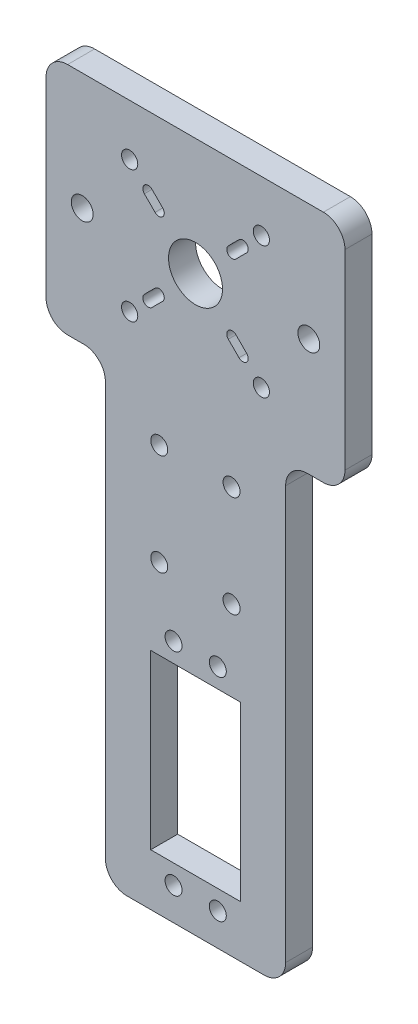
from build123d import *

# Parameters (mm, degrees)
SKETCH1_R           = 2
SKETCH1_R_2         = 6.35
SKETCH1_R_3         = 1.905
SKETCH1_R_4         = 2.575
SKETCH1_W           = 21.082
SKETCH1_H           = 40.64
BOSS_EXTRUDE1_DEPTH = 3.175


with BuildPart() as part:
    # Sketch1 → Boss-Extrude1 (new, symmetric)
    with BuildSketch(Plane.XY):
        with BuildLine():
            Line((-16.129, -83.74), (16.129, -83.74))
            ThreePointArc((16.129, -83.74), (19.721102448, -82.252102448), (21.209, -78.66))
            Line((21.209, -78.66), (21.209, 18.542))
            ThreePointArc((21.209, 18.542), (22.696897552, 22.134102448), (26.289, 23.622))
            Line((26.289, 23.622), (30.099, 23.622))
            ThreePointArc((30.099, 23.622), (33.691102448, 25.109897552), (35.179, 28.702))
            Line((35.179, 28.702), (35.179, 73.66))
            ThreePointArc((35.179, 73.66), (33.691102448, 77.252102448), (30.099, 78.74))
            Line((30.099, 78.74), (-30.099, 78.74))
            ThreePointArc((-30.099, 78.74), (-33.691102448, 77.252102448), (-35.179, 73.66))
            Line((-35.179, 73.66), (-35.179, 28.702))
            ThreePointArc((-35.179, 28.702), (-33.691102448, 25.109897552), (-30.099, 23.622))
            Line((-30.099, 23.622), (-26.289, 23.622))
            ThreePointArc((-26.289, 23.622), (-22.696897552, 22.134102448), (-21.209, 18.542))
            Line((-21.209, 18.542), (-21.209, -78.66))
            ThreePointArc((-21.209, -78.66), (-19.721102448, -82.252102448), (-16.129, -83.74))
        make_face()
        with Locations((8.4836, 11.938)):
            Circle(SKETCH1_R, mode=Mode.SUBTRACT)
        with Locations((-8.5344, 11.938)):
            Circle(SKETCH1_R, mode=Mode.SUBTRACT)
        with Locations((-8.5344, -11.938)):
            Circle(SKETCH1_R, mode=Mode.SUBTRACT)
        with Locations((8.4836, -11.938)):
            Circle(SKETCH1_R, mode=Mode.SUBTRACT)
        with Locations((0, 51.181)):
            Circle(SKETCH1_R_2, mode=Mode.SUBTRACT)
        with Locations((15.494, 66.675)):
            Circle(SKETCH1_R_3, mode=Mode.SUBTRACT)
        with Locations((-15.494, 66.675)):
            Circle(SKETCH1_R_3, mode=Mode.SUBTRACT)
        with Locations((-15.494, 35.687)):
            Circle(SKETCH1_R_3, mode=Mode.SUBTRACT)
        with Locations((15.494, 35.687)):
            Circle(SKETCH1_R_3, mode=Mode.SUBTRACT)
        with Locations((-5.1689, -26.32)):
            Circle(SKETCH1_R, mode=Mode.SUBTRACT)
        with Locations((5.2451, -26.32)):
            Circle(SKETCH1_R, mode=Mode.SUBTRACT)
        with Locations((5.2451, -76.104)):
            Circle(SKETCH1_R, mode=Mode.SUBTRACT)
        with Locations((-5.1689, -76.104)):
            Circle(SKETCH1_R, mode=Mode.SUBTRACT)
        with Locations((-26.67, 51.181)):
            Circle(SKETCH1_R_4, mode=Mode.SUBTRACT)
        with Locations(Location((26.67, 51.181, 0), (0, 0, 180))):
            Circle(SKETCH1_R_4, mode=Mode.SUBTRACT)
        with BuildLine():
            Line((7.723020264, 60.700071488), (10.237491978, 63.214543202))
            ThreePointArc((10.237491978, 63.214543202), (12.033543202, 63.214543202), (12.033543202, 61.418491978))
            Line((12.033543202, 61.418491978), (9.519071488, 58.904020264))
            ThreePointArc((9.519071488, 58.904020264), (7.723020264, 58.904020264), (7.723020264, 60.700071488))
        make_face(mode=Mode.SUBTRACT)
        with BuildLine():
            Line((-9.519071488, 58.904020264), (-12.033543202, 61.418491978))
            ThreePointArc((-12.033543202, 61.418491978), (-12.033543202, 63.214543202), (-10.237491978, 63.214543202))
            Line((-10.237491978, 63.214543202), (-7.723020264, 60.700071488))
            ThreePointArc((-7.723020264, 60.700071488), (-7.723020264, 58.904020264), (-9.519071488, 58.904020264))
        make_face(mode=Mode.SUBTRACT)
        with Locations((0, -51.212)):
            Rectangle(SKETCH1_W, SKETCH1_H, mode=Mode.SUBTRACT)
        with BuildLine():
            Line((-7.723020264, 41.661928512), (-10.237491978, 39.147456798))
            ThreePointArc((-10.237491978, 39.147456798), (-12.033543202, 39.147456798), (-12.033543202, 40.943508022))
            Line((-12.033543202, 40.943508022), (-9.519071488, 43.457979736))
            ThreePointArc((-9.519071488, 43.457979736), (-7.723020264, 43.457979736), (-7.723020264, 41.661928512))
        make_face(mode=Mode.SUBTRACT)
        with BuildLine():
            Line((9.519071488, 43.457979736), (12.033543202, 40.943508022))
            ThreePointArc((12.033543202, 40.943508022), (12.033543202, 39.147456798), (10.237491978, 39.147456798))
            Line((10.237491978, 39.147456798), (7.723020264, 41.661928512))
            ThreePointArc((7.723020264, 41.661928512), (7.723020264, 43.457979736), (9.519071488, 43.457979736))
        make_face(mode=Mode.SUBTRACT)
    extrude(amount=BOSS_EXTRUDE1_DEPTH, both=True)


solid = part.part
